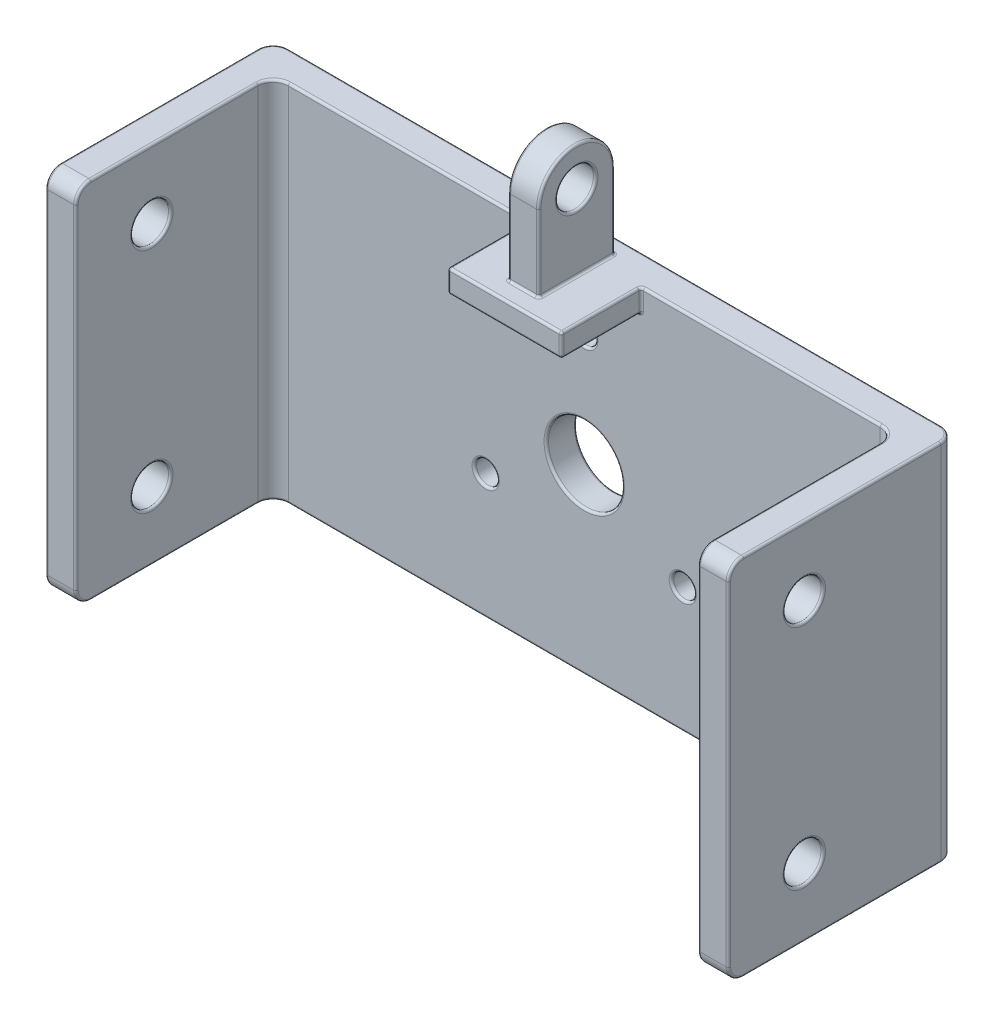
from build123d import *

# Parameters (mm, degrees)
BOSS_EXTRUDE1_DEPTH            = 24
CUT_EXTRUDE1_REACH             = 38.156
SKETCH2_R                      = 1.25
CUT_EXTRUDE1_DIRECTION_2_REACH = 38.156
SKETCH3_R                      = 2.5
SKETCH3_R_2                    = 0.75
CUT_EXTRUDE2_DEPTH             = 2
FILLET1_R                      = 1
FILLET2_R                      = 1
SKETCH4_W                      = 7.5
SKETCH4_H                      = 5.25
BOSS_EXTRUDE2_DEPTH            = 1.5
BOSS_EXTRUDE3_DEPTH            = 1
BOSS_EXTRUDE3_DEPTH_BACK       = 1
SKETCH5_R                      = 1.25
FILLET3_R                      = 0.15


with BuildPart() as part:
    # Sketch1 → Boss-Extrude1 (new body)
    with BuildSketch(Plane(origin=(0, 0, 0), x_dir=(1, 0, 0), z_dir=(0, 1, 0))):
        Polygon((-22.5, -15), (-22.5, 0), (22.5, 0), (22.5, -15), (20.5, -15), (20.5, -2), (-20.5, -2), (-20.5, -15), align=None)
    extrude(amount=BOSS_EXTRUDE1_DEPTH)

    # Cut-Extrude1: up to this face of the body (flat: up to its plane)
    cut_extrude1_end = Plane(part.part.faces().sort_by_distance((-22.5, 12, 7.5))[0])
    # Sketch2 → Cut-Extrude1 (cut, up to the picked face)
    with BuildSketch(Plane(origin=(0, 0, 0), x_dir=(0, 0, -1), z_dir=(1, 0, 0)), mode=Mode.PRIVATE) as cut_extrude1_sk1:
        with Locations((-10, 19.5)):
            Circle(SKETCH2_R)
    cut_extrude1_tool1 = split(extrude(cut_extrude1_sk1.sketch, amount=-CUT_EXTRUDE1_REACH, mode=Mode.PRIVATE), bisect_by=cut_extrude1_end, keep=Keep.BOTH, mode=Mode.PRIVATE)
    # Sketch2 → Cut-Extrude1 (cut, up to the picked face)
    with BuildSketch(Plane(origin=(0, 0, 0), x_dir=(0, 0, -1), z_dir=(1, 0, 0)), mode=Mode.PRIVATE) as cut_extrude1_sk2:
        with Locations((-10, 4.5)):
            Circle(SKETCH2_R)
    cut_extrude1_tool2 = split(extrude(cut_extrude1_sk2.sketch, amount=-CUT_EXTRUDE1_REACH, mode=Mode.PRIVATE), bisect_by=cut_extrude1_end, keep=Keep.BOTH, mode=Mode.PRIVATE)
    add(cut_extrude1_tool1.solids().sort_by(Axis((0, 19.5, 10), (-1, 0, 0)))[0], mode=Mode.SUBTRACT)
    add(cut_extrude1_tool2.solids().sort_by(Axis((0, 4.5, 10), (-1, 0, 0)))[0], mode=Mode.SUBTRACT)

    # Cut-Extrude1 direction 2: up to this face of the body (flat: up to its plane)
    cut_extrude1_direction_2_end = Plane(part.part.faces().sort_by_distance((22.5, 12, 7.5))[0])
    # Sketch2 → Cut-Extrude1 direction 2 (cut, up to the picked face)
    with BuildSketch(Plane(origin=(0, 0, 0), x_dir=(0, 0, -1), z_dir=(1, 0, 0)), mode=Mode.PRIVATE) as cut_extrude1_direction_2_sk1:
        with Locations((-10, 19.5)):
            Circle(SKETCH2_R)
    cut_extrude1_direction_2_tool1 = split(extrude(cut_extrude1_direction_2_sk1.sketch, amount=CUT_EXTRUDE1_DIRECTION_2_REACH, mode=Mode.PRIVATE), bisect_by=cut_extrude1_direction_2_end, keep=Keep.BOTH, mode=Mode.PRIVATE)
    # Sketch2 → Cut-Extrude1 direction 2 (cut, up to the picked face)
    with BuildSketch(Plane(origin=(0, 0, 0), x_dir=(0, 0, -1), z_dir=(1, 0, 0)), mode=Mode.PRIVATE) as cut_extrude1_direction_2_sk2:
        with Locations((-10, 4.5)):
            Circle(SKETCH2_R)
    cut_extrude1_direction_2_tool2 = split(extrude(cut_extrude1_direction_2_sk2.sketch, amount=CUT_EXTRUDE1_DIRECTION_2_REACH, mode=Mode.PRIVATE), bisect_by=cut_extrude1_direction_2_end, keep=Keep.BOTH, mode=Mode.PRIVATE)
    add(cut_extrude1_direction_2_tool1.solids().sort_by(Axis((0, 19.5, 10), (1, 0, 0)))[0], mode=Mode.SUBTRACT)
    add(cut_extrude1_direction_2_tool2.solids().sort_by(Axis((0, 4.5, 10), (1, 0, 0)))[0], mode=Mode.SUBTRACT)

    # Sketch3 → Cut-Extrude2 (cut)
    with BuildSketch(Plane.XY):
        with Locations(Location((0, 12, 0), (0, 0, 180))):
            Circle(SKETCH3_R)
        with Locations(Location((0, 19.5, 0), (0, 0, 180))):
            Circle(SKETCH3_R_2)
        with Locations(Location((6.495190528, 8.25, 0), (0, 0, 180))):
            Circle(SKETCH3_R_2)
        with Locations(Location((-6.495190528, 8.25, 0), (0, 0, 180))):
            Circle(SKETCH3_R_2)
    extrude(amount=CUT_EXTRUDE2_DEPTH, mode=Mode.SUBTRACT)

    # Fillet1
    fillet1_edges = [part.edges().sort_by_distance(p)[0] for p in [
        (-21.5, 0, 15),
        (21.5, 24, 15),
        (-21.5, 24, 15),
        (21.5, 0, 15),
    ]]
    fillet(fillet1_edges, radius=FILLET1_R)

    # Fillet2
    fillet2_edges = [part.edges().sort_by_distance(p)[0] for p in [
        (-22.5, 12, 0),
        (22.5, 12, 0),
        (20.5, 12, 2),
        (-20.5, 12, 2),
    ]]
    fillet(fillet2_edges, radius=FILLET2_R)

    # Sketch4 → Boss-Extrude2 (add)
    with BuildSketch(Plane(origin=(0, 24, 0), x_dir=(1, 0, 0), z_dir=(0, 1, 0))):
        with Locations((0, -4.625)):
            Rectangle(SKETCH4_W, SKETCH4_H)
    extrude(amount=-BOSS_EXTRUDE2_DEPTH)

    # Sketch5 → Boss-Extrude3 (add, two sides: drawn at the far end of the back side and taken through both)
    with BuildSketch(Plane(origin=(0, 0, 0), x_dir=(0, 0, -1), z_dir=(1, 0, 0)).offset(-BOSS_EXTRUDE3_DEPTH_BACK)):
        with BuildLine():
            Line((-1, 29), (-1, 24))
            Line((-1, 24), (-6, 24))
            Line((-6, 24), (-6, 29))
            ThreePointArc((-6, 29), (-3.5, 31.5), (-1, 29))
        make_face()
        with Locations((-3.5, 29)):
            Circle(SKETCH5_R, mode=Mode.SUBTRACT)
    extrude(amount=BOSS_EXTRUDE3_DEPTH + BOSS_EXTRUDE3_DEPTH_BACK)

    # Fillet3
    fillet3_edges = [part.edges().sort_by_distance(p)[0] for p in [
        (11.625, 24, 2),
        (3.75, 22.5, 4.625),
        (3.75, 23.25, 2),
        (0, 22.5, 7.25),
        (3.75, 23.25, 7.25),
        (-3.75, 22.5, 4.625),
        (-3.75, 23.25, 7.25),
        (0, 22.5, 2),
        (-3.75, 23.25, 2),
        (3.75, 24, 4.625),
        (-3.75, 24, 4.625),
        (0, 24, 7.25),
        (-1, 31.5, 3.5),
        (-1, 26.5, 1),
        (0, 24, 1),
        (-1, 24, 3.5),
        (0, 24, 6),
        (-1, 26.5, 6),
        (-1, 29, 4.75),
        (1, 29, 4.75),
        (1, 31.5, 3.5),
        (1, 26.5, 6),
        (1, 24, 3.5),
        (1, 26.5, 1),
        (-20.5, 19.5, 11.25),
        (22.5, 19.5, 11.25),
        (20.5, 19.5, 11.25),
        (-22.5, 19.5, 11.25),
        (-20.5, 4.5, 11.25),
        (22.5, 4.5, 11.25),
        (20.5, 4.5, 11.25),
        (-22.5, 4.5, 11.25),
        (-5.745190528, 8.25, 2),
        (-5.745190528, 8.25, 0),
        (7.245190528, 8.25, 2),
        (7.245190528, 8.25, 0),
        (0.75, 19.5, 2),
        (0.75, 19.5, 0),
        (2.5, 12, 2),
        (2.5, 12, 0),
        (22.5, 12, 15),
        (20.5, 12, 15),
        (22.5, 0, 7.5),
        (22.5, 24, 7.5),
        (22.5, 23.707106781, 14.707106781),
        (22.5, 0.292893219, 14.707106781),
        (-20.5, 0, 8.5),
        (20.5, 23.707106781, 14.707106781),
        (20.5, 0.292893219, 14.707106781),
        (-20.5, 24, 8.5),
        (-20.5, 12, 15),
        (-22.5, 12, 15),
        (-20.5, 23.707106781, 14.707106781),
        (-20.5, 0.292893219, 14.707106781),
        (-22.5, 23.707106781, 14.707106781),
        (-22.5, 0.292893219, 14.707106781),
        (0, 0, 0),
        (0, 24, 0),
        (20.5, 0, 8.5),
        (0, 0, 2),
        (-22.5, 0, 7.5),
        (-22.207106781, 0, 0.292893219),
        (22.207106781, 0, 0.292893219),
        (20.5, 24, 8.5),
        (-22.5, 24, 7.5),
        (-11.625, 24, 2),
        (-22.207106781, 24, 0.292893219),
        (22.207106781, 24, 0.292893219),
        (-20.207106781, 0, 2.292893219),
        (-20.207106781, 24, 2.292893219),
        (20.207106781, 0, 2.292893219),
        (20.207106781, 24, 2.292893219),
    ]]
    fillet(fillet3_edges, radius=FILLET3_R)


solid = part.part
